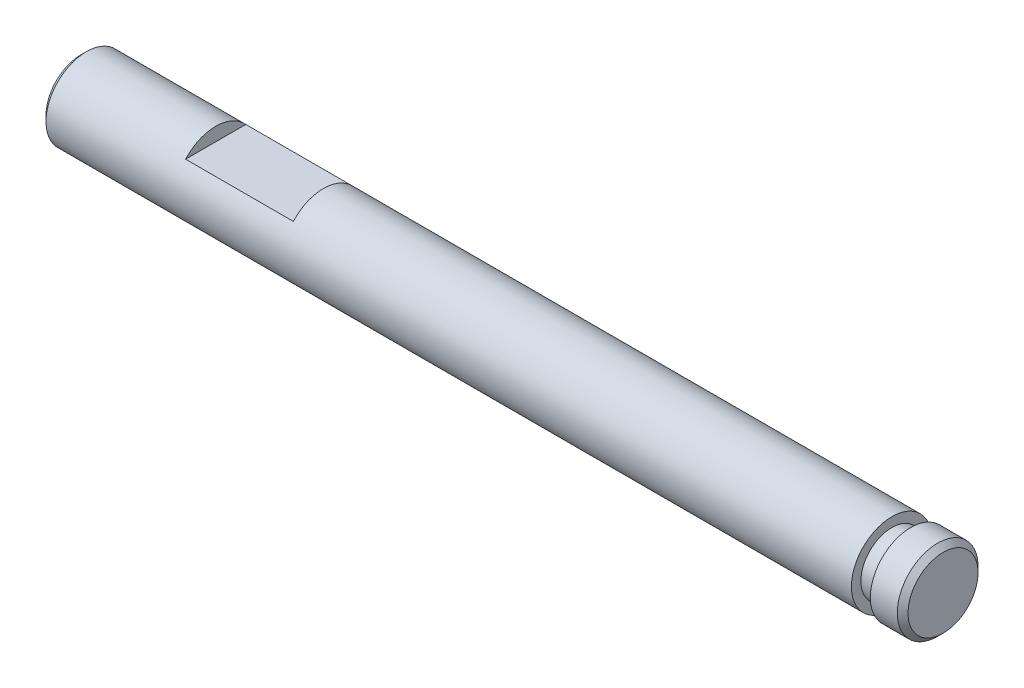
from build123d import *

# Parameters (mm, degrees)
CHANFREIN1_SIZE       = 0.2
EXTRUSION1_DEPTH      = 10
EXTRUSION1_DEPTH_BACK = 10
ESQUISSE2_W           = 4
ESQUISSE2_H           = 1.988568473


with BuildPart() as part:
    # Esquisse1 → Révolution1 (revolve)
    with BuildSketch(Plane.XY):
        Polygon((32, 0), (32, 1.5), (30.8, 1.5), (30.8, 1.15), (30.1, 1.15), (30.1, 1.5), (0, 1.5), (0, 0), align=None)
    revolve(axis=Axis((0, 0, 0), (1, 0, 0)))

    # Chanfrein1
    chanfrein1_edges = [part.edges().sort_by_distance(p)[0] for p in [
        (32, -1.5, 0),
        (0, -1.5, 0),
    ]]
    chamfer(chanfrein1_edges, length=CHANFREIN1_SIZE)

    # Esquisse2 → Extrusion1 (cut, two sides: drawn at the far end of the back side and taken through both)
    with BuildSketch(Plane.XY.offset(-EXTRUSION1_DEPTH_BACK)):
        with Locations((7, 1.994284237)):
            Rectangle(ESQUISSE2_W, ESQUISSE2_H)
    extrude(amount=EXTRUSION1_DEPTH + EXTRUSION1_DEPTH_BACK, mode=Mode.SUBTRACT)


solid = part.part
